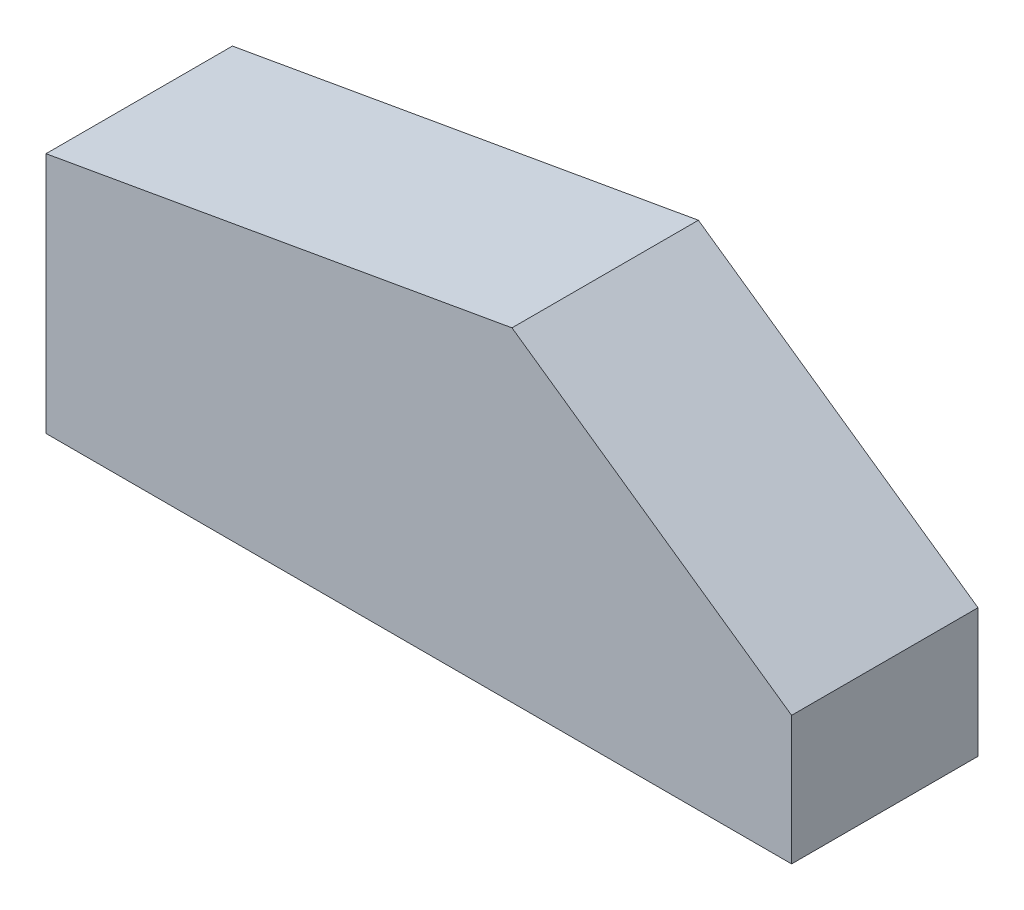
from build123d import *

# Parameters (mm, degrees)
SALIENTE_EXTRUIR1_DEPTH = 10


with BuildPart() as part:
    # Croquis1 → Saliente-Extruir1 (new body)
    with BuildSketch(Plane.XY):
        Polygon((0, 0), (0, 13), (25, 17.408174518), (40, 6.905061445), (40, 0), align=None)
    extrude(amount=SALIENTE_EXTRUIR1_DEPTH)


solid = part.part
